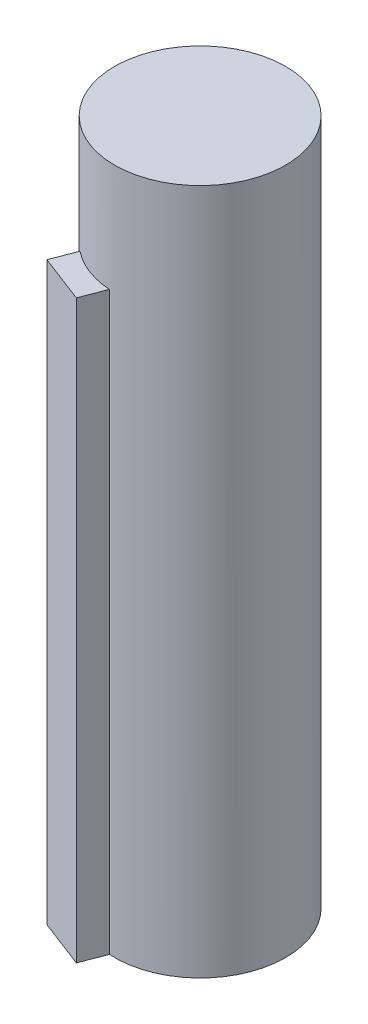
from build123d import *

# Parameters (mm, degrees)
BOSS_EXTRUDE1_DEPTH = 90
SKETCH3_R           = 13.36858006
BOSS_EXTRUDE2_DEPTH = 550
SKETCH4_R           = 30
CUT_EXTRUDE1_DEPTH  = 532.76


with BuildPart() as part:
    # Sketch2 → Boss-Extrude1 (new body)
    with BuildSketch(Plane(origin=(0, 0, 0), x_dir=(1, 0, 0), z_dir=(0, 1, 0))):
        with BuildLine():
            Line((-0.832718515, -13.342620159), (-2.264973014, -17.077408915))
            Line((-2.264973014, -17.077408915), (-9.734550526, -14.212899917))
            Line((-9.734550526, -14.212899917), (-8.302296027, -10.478111162))
            ThreePointArc((-8.302296027, -10.478111162), (4.786802233, 12.482205623), (-0.832718515, -13.342620159))
        make_face()
    extrude(amount=BOSS_EXTRUDE1_DEPTH)

    # Sketch3 → Boss-Extrude2 (add)
    with BuildSketch(Plane(origin=(0, 90, 0), x_dir=(1, 0, 0), z_dir=(0, 1, 0))):
        with Locations(Location((0, 0, 0), (0, 0, 231.608573475))):
            Circle(SKETCH3_R)
    extrude(amount=BOSS_EXTRUDE2_DEPTH)

    # Sketch4 → Cut-Extrude1 (cut)
    with BuildSketch(Plane(origin=(0, 640, 0), x_dir=(1, 0, 0), z_dir=(0, 1, 0))):
        Circle(SKETCH4_R)
    extrude(amount=-CUT_EXTRUDE1_DEPTH, mode=Mode.SUBTRACT)


solid = part.part
